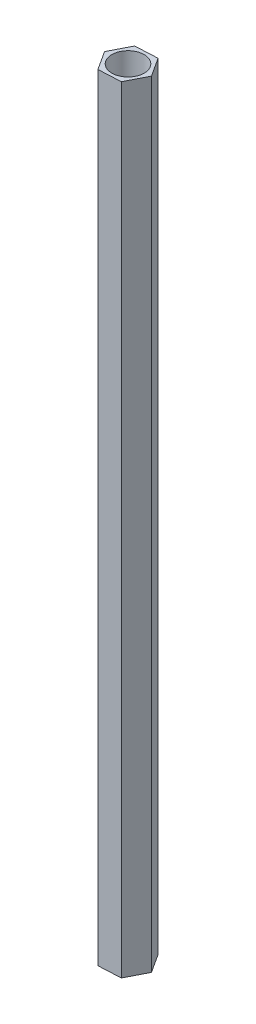
from build123d import *

# Parameters (mm, degrees)
EXTRUDE_1_DEPTH     = 55.63
SKETCH_2_R          = 1.25
CUT_EXTRUDE_1_DEPTH = 55.63
EXTRUDE_START       = 4.490261
SKETCH_3_R          = 1.25
EXTRUDE_2_DEPTH     = 4.490261


with BuildPart() as part:
    # 草图1 → 凸台-拉伸1 (new body)
    with BuildSketch(Plane(origin=(0, 0, 0), x_dir=(1, 0, 0), z_dir=(0, 1, 0))):
        Polygon((0.940938815, -1.454178169), (1.729824643, 0.087787833), (0.788885828, 1.541966002), (-0.940938815, 1.454178169), (-1.729824643, -0.087787833), (-0.788885828, -1.541966002), align=None)
    extrude(amount=EXTRUDE_1_DEPTH)

    # 草图2 → 切除-拉伸1 (cut)
    with BuildSketch(Plane(origin=(0, 55.63, 0), x_dir=(1, 0, 0), z_dir=(0, 1, 0))):
        with Locations(Location((0, 0, 0), (0, 0, 270))):
            Circle(SKETCH_2_R)
    extrude(amount=-CUT_EXTRUDE_1_DEPTH, mode=Mode.SUBTRACT)

    # 草图3 → 凸台-拉伸2 (add)
    with BuildSketch(Plane(origin=(0, 55.63, 0), x_dir=(1, 0, 0), z_dir=(0, 1, 0)).offset(EXTRUDE_START)):
        Polygon((0.788885828, 1.541966002), (-0.940938815, 1.454178169), (-1.729824643, -0.087787833), (-0.788885828, -1.541966002), (0.940938815, -1.454178169), (1.729824643, 0.087787833), align=None)
        with Locations(Location((0, 0, 0), (0, 0, 270))):
            Circle(SKETCH_3_R, mode=Mode.SUBTRACT)
    extrude(amount=-EXTRUDE_2_DEPTH)


solid = part.part
